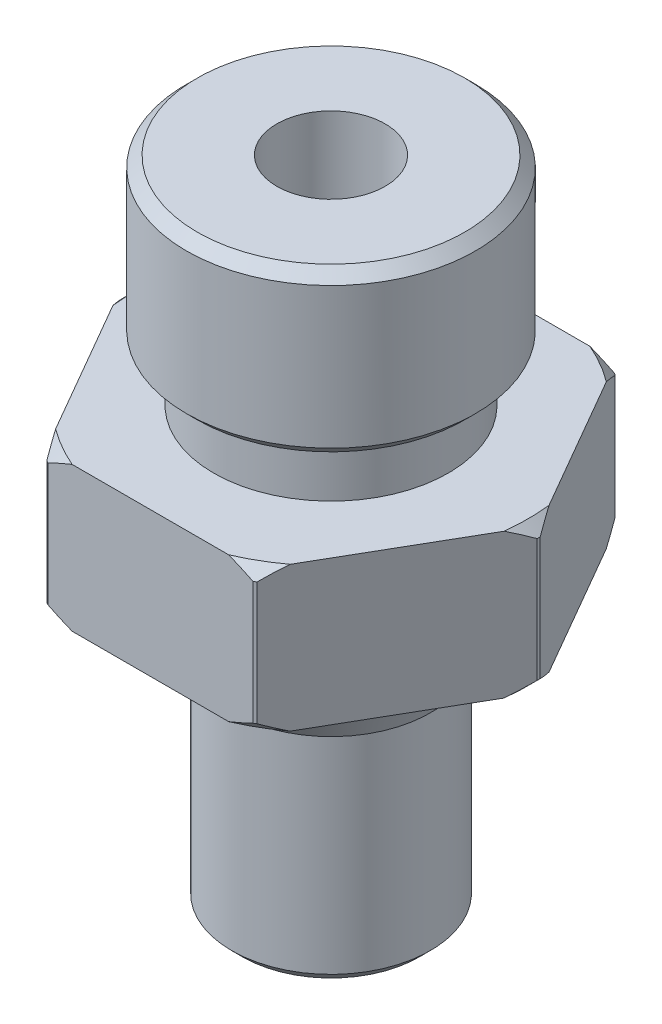
from build123d import *

# Parameters (mm, degrees)
CHAMFER_1_SIZE      = 0.3
SKETCH_2_OUTSIDE_W  = 18.352
SKETCH_2_OUTSIDE_H  = 18.352
CUT_EXTRUDE_1_DEPTH = 15.495689014


with BuildPart() as part:
    # Эскиз1 → Повернуть1 (revolve)
    with BuildSketch(Plane.XY):
        Polygon((1.5, 0), (4, 0), (4, -4.5), (3.25, -4.5), (3.25, -6), (5.75, -6), (5.75, -10), (3.682615316, -10), (2.75, -12), (2.75, -18), (1.5, -18), align=None)
    revolve(axis=Axis((0, 8.266911596, 0), (0, -1, 0)))

    # Фаска1
    chamfer_1_edges = [part.edges().sort_by_distance(p)[0] for p in [
        (-5.75, -10, 0),
        (-5.75, -6, 0),
        (-4, -4.5, 0),
        (-4, 0, 0),
        (-1.5, -18, 0),
        (-2.75, -18, 0),
    ]]
    chamfer(chamfer_1_edges, length=CHAMFER_1_SIZE)

    # Эскиз2 outside → Вырез-Вытянуть1 (cut, through all)
    with BuildSketch(Plane(origin=(0, -6, 0), x_dir=(1, 0, 0), z_dir=(0, 1, 0))):
        Rectangle(SKETCH_2_OUTSIDE_W, SKETCH_2_OUTSIDE_H)
        Polygon((5.773502692, 0), (2.886751346, 5), (-2.886751346, 5), (-5.773502692, 0), (-2.886751346, -5), (2.886751346, -5), align=None, mode=Mode.SUBTRACT)
    extrude(amount=-CUT_EXTRUDE_1_DEPTH, mode=Mode.SUBTRACT)


solid = part.part
